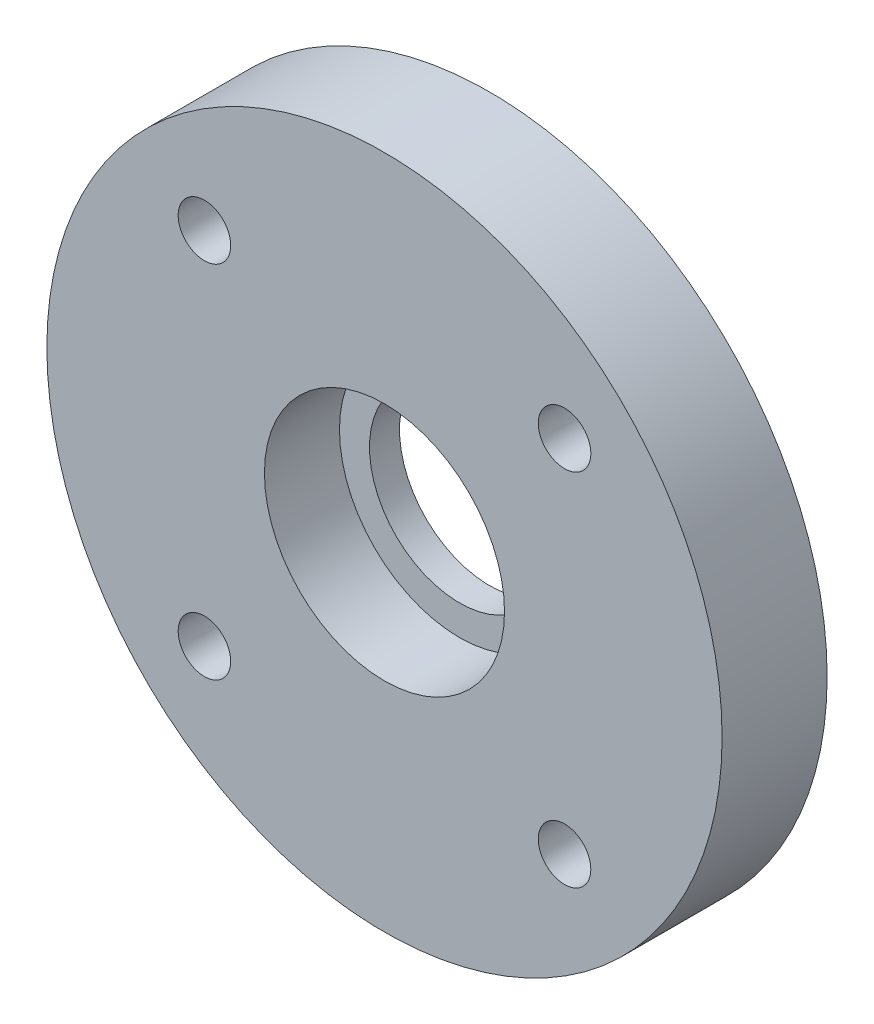
from build123d import *

# Parameters (mm, degrees)
SKETCH1_R           = 22.5
SKETCH1_R_2         = 6
BOSS_EXTRUDE1_DEPTH = 7
SKETCH2_R           = 8
CUT_EXTRUDE1_DEPTH  = 5
SKETCH3_R           = 1.75
CUT_EXTRUDE2_DEPTH  = 33.580669115


with BuildPart() as part:
    # Sketch1 → Boss-Extrude1 (new body)
    with BuildSketch(Plane.XY):
        Circle(SKETCH1_R)
        Circle(SKETCH1_R_2, mode=Mode.SUBTRACT)
    extrude(amount=BOSS_EXTRUDE1_DEPTH)

    # Sketch2 → Cut-Extrude1 (cut)
    with BuildSketch(Plane.XY.offset(7)):
        Circle(SKETCH2_R)
    extrude(amount=-CUT_EXTRUDE1_DEPTH, mode=Mode.SUBTRACT)

    # Sketch3 → Cut-Extrude2 (cut, through all)
    with BuildSketch(Plane.XY.offset(7)):
        with Locations((-12, 12)):
            Circle(SKETCH3_R)
        with Locations(Location((12, 12, 0), (0, 0, 180))):
            Circle(SKETCH3_R)
        with Locations((12, -12)):
            Circle(SKETCH3_R)
        with Locations(Location((-12, -12, 0), (0, 0, 180))):
            Circle(SKETCH3_R)
    extrude(amount=-CUT_EXTRUDE2_DEPTH, mode=Mode.SUBTRACT)


solid = part.part
